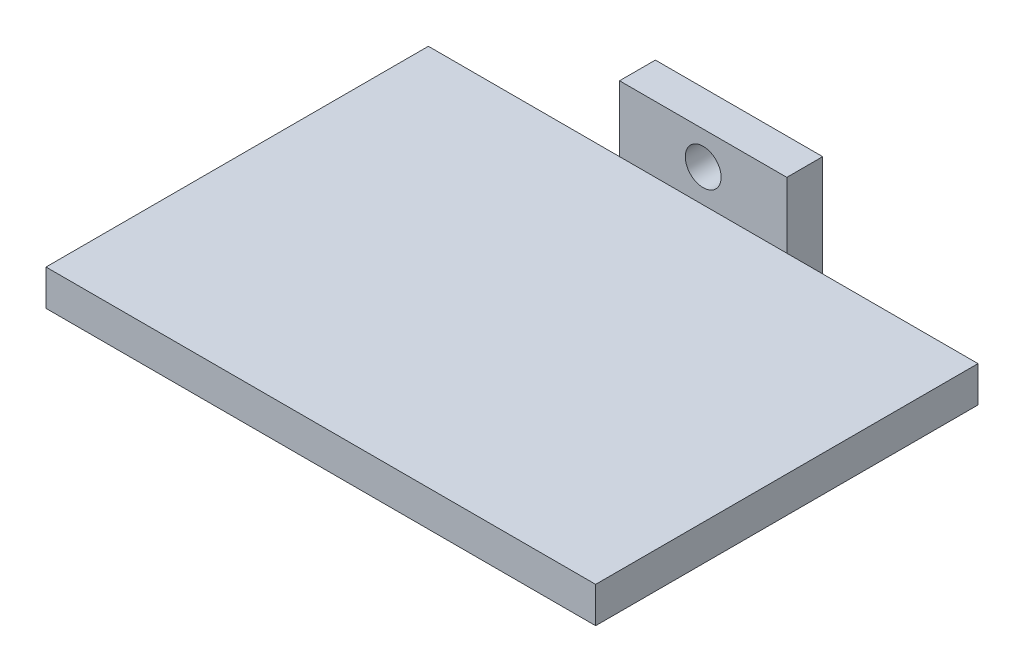
from build123d import *

# Parameters (mm, degrees)
SKETCH1_W             = 14
SKETCH1_H             = 14
BOSS_EXTRUDE1_DEPTH   = 3
SKETCH2_W             = 46
SKETCH2_H             = 3
BOSS_EXTRUDE2_DEPTH   = 32
F_3_0MM_DOWEL_HOLE1_D = 3


with BuildPart() as part:
    # Sketch1 → Boss-Extrude1 (new body)
    with BuildSketch(Plane.XY):
        Rectangle(SKETCH1_W, SKETCH1_H)
    extrude(amount=BOSS_EXTRUDE1_DEPTH)

    # Sketch2 → Boss-Extrude2 (add)
    with BuildSketch(Plane.XY.offset(3)):
        Rectangle(SKETCH2_W, SKETCH2_H)
    extrude(amount=BOSS_EXTRUDE2_DEPTH)

    # Ø3.0mm Dowel Hole1 (through all)
    with Locations(Plane.XY.offset(3)):
        with Locations((0, 4.25), (0, -4.25)):
            Hole(F_3_0MM_DOWEL_HOLE1_D / 2)


solid = part.part
